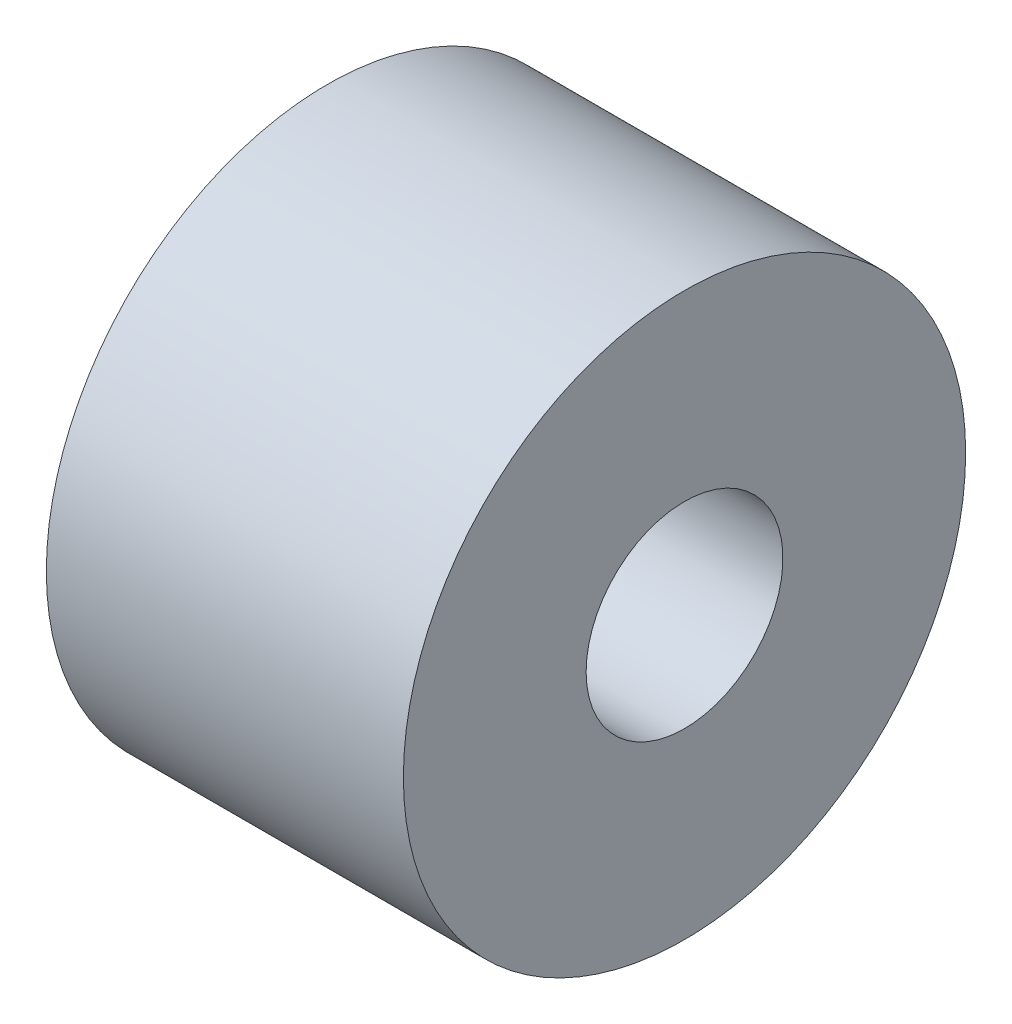
from build123d import *

# Parameters (mm, degrees)
SKETCH1_R           = 10
BOSS_EXTRUDE1_DEPTH = 12.7
SKETCH2_R           = 3.5
CUT_EXTRUDE1_DEPTH  = 12.7


with BuildPart() as part:
    # Sketch1 → Boss-Extrude1 (new body)
    with BuildSketch(Plane(origin=(0, 0, 0), x_dir=(0, 0, -1), z_dir=(1, 0, 0))):
        Circle(SKETCH1_R)
    extrude(amount=BOSS_EXTRUDE1_DEPTH)

    # Sketch2 → Cut-Extrude1 (cut)
    with BuildSketch(Plane.ZY):
        Circle(SKETCH2_R)
    extrude(amount=-CUT_EXTRUDE1_DEPTH, mode=Mode.SUBTRACT)


solid = part.part
